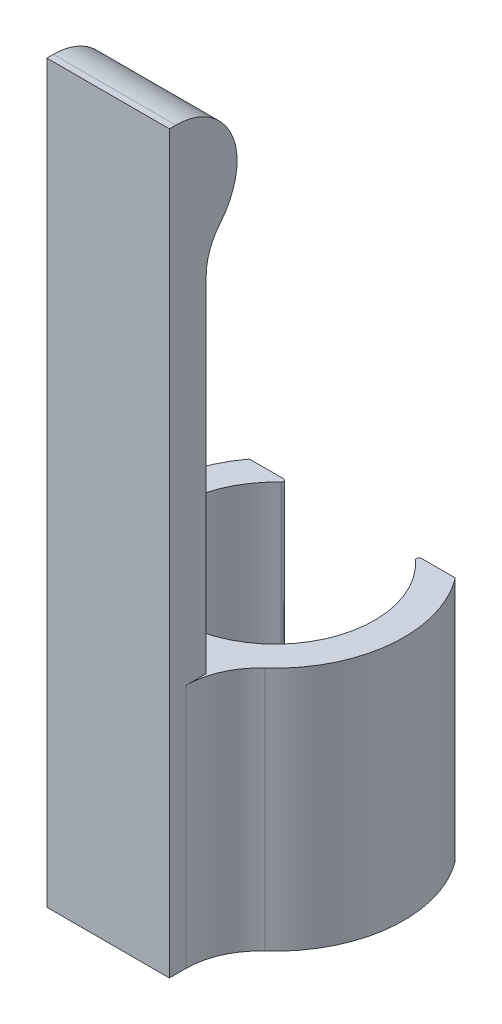
from build123d import *

# Parameters (mm, degrees)
BOSS_EXTRUDE1_DEPTH = 10
FILLET3_R           = 3
SKETCH1_3_W         = 5
SKETCH1_3_H         = 1.5
BOSS_EXTRUDE2_DEPTH = 30
BOSS_EXTRUDE3_DEPTH = 2.5
FILLET1_R           = 2.5
FILLET4_R           = 0.1


with BuildPart() as part:
    # Sketch1 → Boss-Extrude1 (new body)
    with BuildSketch(Plane(origin=(0, 0, 0), x_dir=(1, 0, 0), z_dir=(0, 1, 0))):
        with BuildLine():
            Line((-2.545584412, 3.15), (-4.2, 3.15))
            ThreePointArc((-4.2, 3.15), (-5.128577821, -1.122581638), (-2.5, -4.616546328))
            Line((-2.5, -4.616546328), (-2.5, -6.816546328))
            Line((-2.5, -6.816546328), (2.5, -6.816546328))
            Line((2.5, -6.816546328), (2.5, -4.616546328))
            ThreePointArc((2.5, -4.616546328), (5.128577821, -1.122581638), (4.2, 3.15))
            Line((4.2, 3.15), (2.545584412, 3.15))
            ThreePointArc((2.545584412, 3.15), (0, -4.05), (-2.545584412, 3.15))
        make_face()
    extrude(amount=BOSS_EXTRUDE1_DEPTH)

    # Fillet3
    fillet3_edges = [part.edges().sort_by_distance(p)[0] for p in [
        (2.5, 5, 4.616546328),
        (-2.5, 5, 4.616546328),
    ]]
    fillet(fillet3_edges, radius=FILLET3_R)

    # Sketch1<3> → Boss-Extrude2 (add)
    with BuildSketch(Plane(origin=(0, 0, 0), x_dir=(1, 0, 0), z_dir=(0, 1, 0))):
        with Locations((0, -6.066546328)):
            Rectangle(SKETCH1_3_W, SKETCH1_3_H)
    extrude(amount=BOSS_EXTRUDE2_DEPTH)

    # Sketch2 → Boss-Extrude3 (add, symmetric)
    with BuildSketch(Plane.ZY):
        with BuildLine():
            Line((5.316546328, 25.10300567), (5.316546328, 30))
            ThreePointArc((5.316546328, 30), (4.05, 27.551502835), (5.316546328, 25.10300567))
        make_face()
    extrude(amount=BOSS_EXTRUDE3_DEPTH, both=True)

    # Fillet1
    fillet1_edges = [part.edges().sort_by_distance(p)[0] for p in [
        (0, 25.10300567, 5.316546328),
        (0, 30, 5.316546328),
    ]]
    fillet(fillet1_edges, radius=FILLET1_R)

    # Fillet4
    fillet4_edges = [part.edges().sort_by_distance(p)[0] for p in [
        (4.2, 5, -3.15),
        (-4.2, 5, -3.15),
        (-2.545584412, 5, -3.15),
        (2.545584412, 5, -3.15),
    ]]
    fillet(fillet4_edges, radius=FILLET4_R)


solid = part.part
